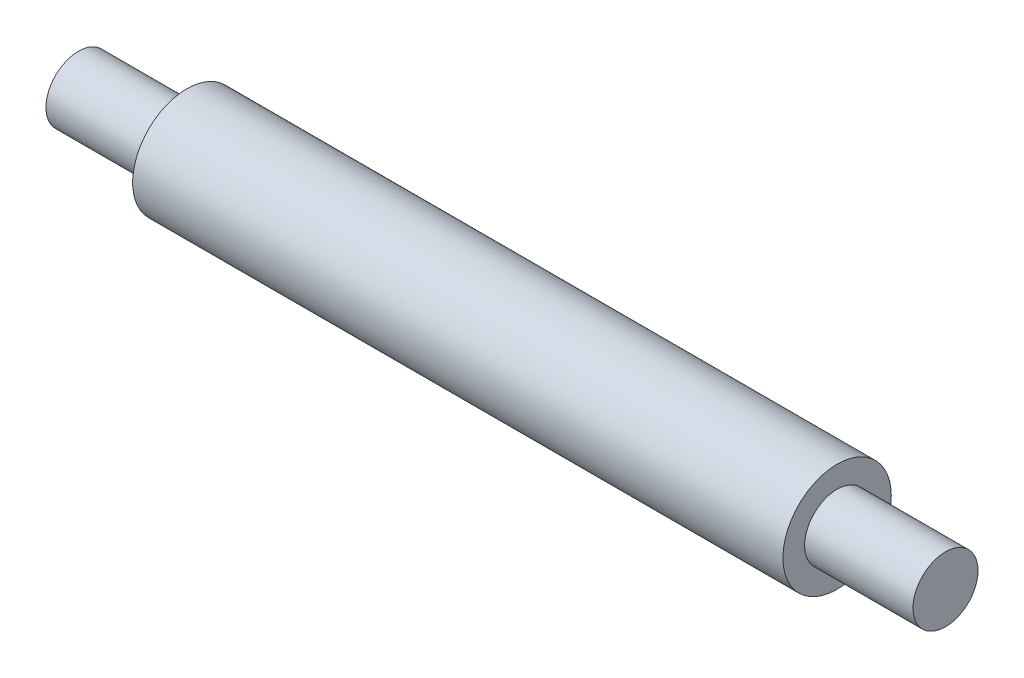
from build123d import *

# Parameters (mm, degrees)
BOSS_EXTRUDE1_DEPTH      = 30
BOSS_EXTRUDE1_DEPTH_BACK = 30
SKETCH1_R                = 5
SKETCH2_R                = 3
BOSS_EXTRUDE2_DEPTH      = 10


with BuildPart() as part:
    # Sketch1 → Boss-Extrude1 (new, two sides: drawn at the far end of the back side and taken through both)
    with BuildSketch(Plane(origin=(0, 0, 0), x_dir=(0, 0, -1), z_dir=(1, 0, 0)).offset(-BOSS_EXTRUDE1_DEPTH_BACK)):
        Circle(SKETCH1_R)
    extrude(amount=BOSS_EXTRUDE1_DEPTH + BOSS_EXTRUDE1_DEPTH_BACK)

    # Sketch2 → Boss-Extrude2 (add)
    with BuildSketch(Plane(origin=(30, 0, 0), x_dir=(0, 0, -1), z_dir=(1, 0, 0))):
        Circle(SKETCH2_R)
    boss_extrude2 = extrude(amount=BOSS_EXTRUDE2_DEPTH)

    # Mirror1: Boss-Extrude2 across plane
    add(boss_extrude2.mirror(Plane(origin=(0, 0, 0), x_dir=(0, 0, 1), z_dir=(1, 0, 0))))


solid = part.part
